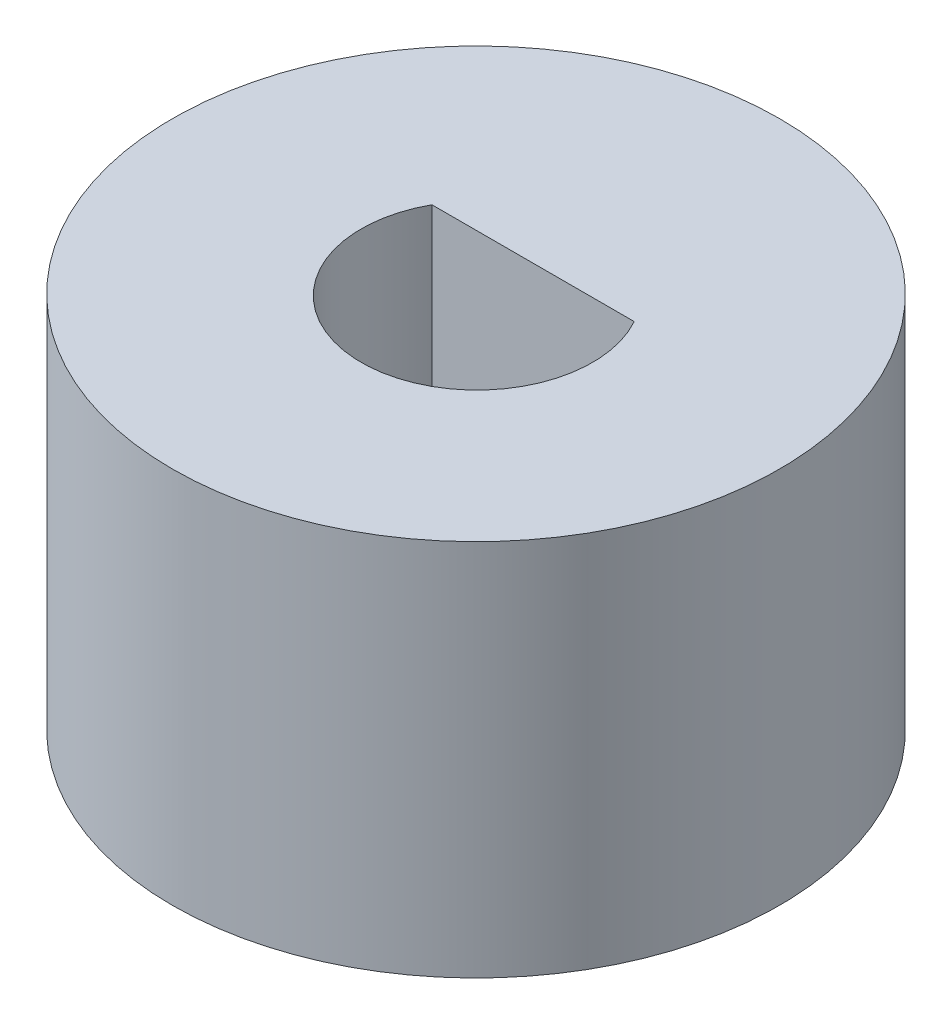
from build123d import *

# Parameters (mm, degrees)
SKETCH1_R           = 8.595
BOSS_EXTRUDE1_DEPTH = 9.7
BOSS_EXTRUDE3_START = 1
SKETCH2_R           = 8.595
BOSS_EXTRUDE3_DEPTH = 1


with BuildPart() as part:
    # Sketch1 → Boss-Extrude1 (new body)
    with BuildSketch(Plane(origin=(0, 0, 0), x_dir=(1, 0, 0), z_dir=(0, 1, 0))):
        with Locations(Location((0, 0, 0), (0, 0, 270))):
            Circle(SKETCH1_R)
        with BuildLine():
            Line((2.921067116, 1.559875967), (-2.806515464, 1.559875967))
            ThreePointArc((-2.806515464, 1.559875967), (0.057275826, -3.308241049), (2.921067116, 1.559875967))
        make_face(mode=Mode.SUBTRACT)
    extrude(amount=BOSS_EXTRUDE1_DEPTH)

    # Sketch2 → Boss-Extrude3 (add)
    with BuildSketch(Plane.XZ.offset(BOSS_EXTRUDE3_START)):
        with Locations(Location((0, 0, 0), (0, 0, 270))):
            Circle(SKETCH2_R)
    extrude(amount=-BOSS_EXTRUDE3_DEPTH)


solid = part.part
